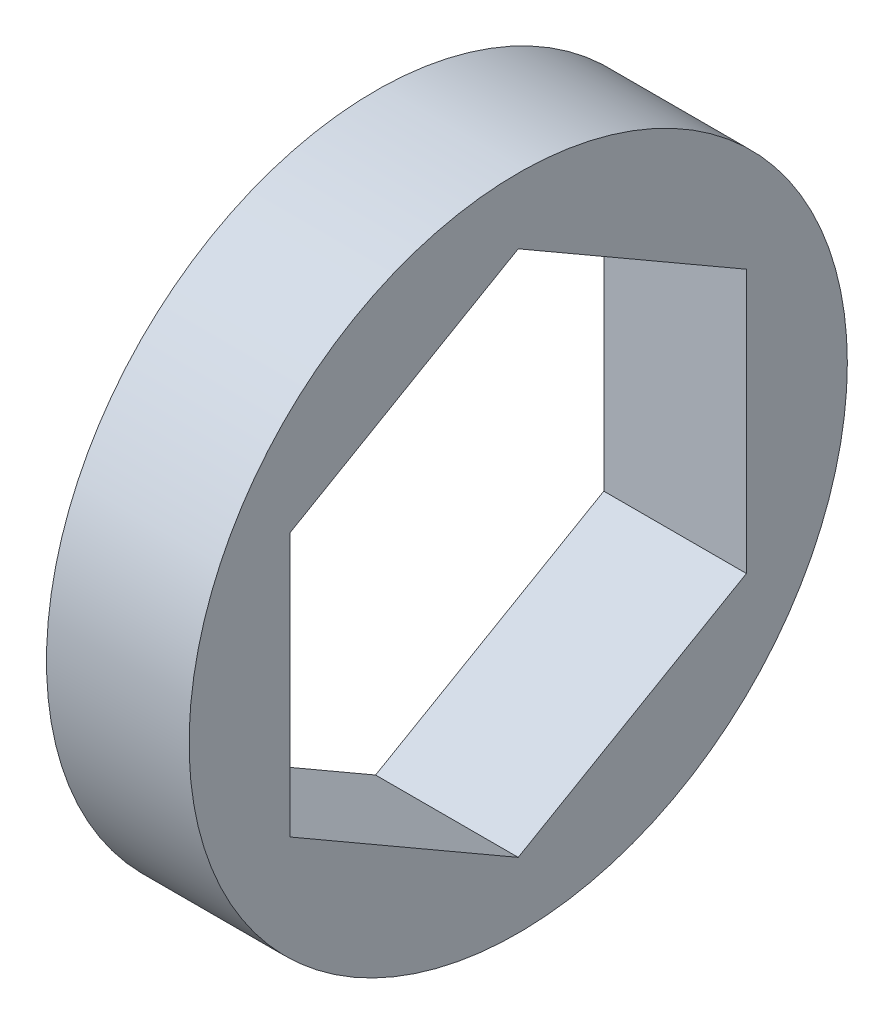
from build123d import *

# Parameters (mm, degrees)
SKETCH1_R           = 9.525
BOSS_EXTRUDE1_DEPTH = 4.1275


with BuildPart() as part:
    # Sketch1 → Boss-Extrude1 (new body)
    with BuildSketch(Plane(origin=(0, 0, 0), x_dir=(0, 0, -1), z_dir=(1, 0, 0))):
        Circle(SKETCH1_R)
        Polygon((0, 7.625642355), (-6.604, 3.812821178), (-6.604, -3.812821178), (0, -7.625642355), (6.604, -3.812821178), (6.604, 3.812821178), align=None, mode=Mode.SUBTRACT)
    extrude(amount=BOSS_EXTRUDE1_DEPTH)


solid = part.part
